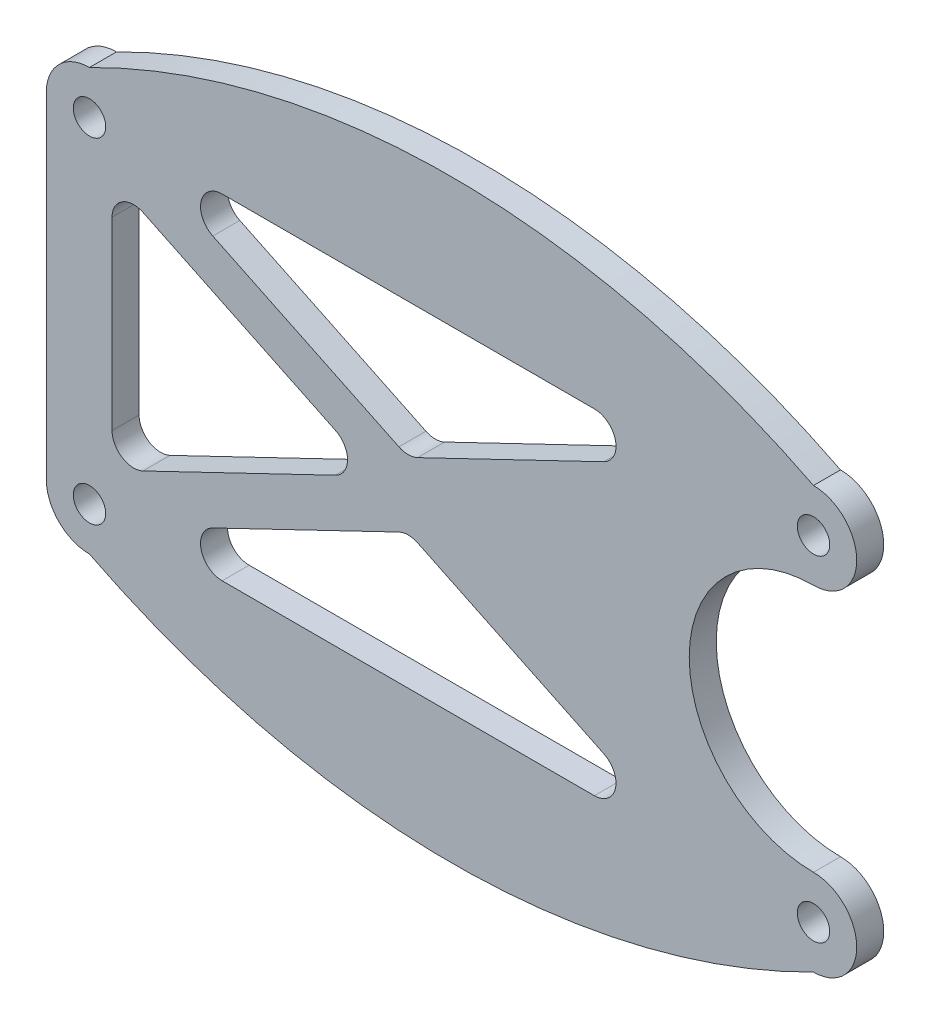
from build123d import *

# Parameters (mm, degrees)
CROQUIS2_R              = 1.5
SALIENTE_EXTRUIR1_DEPTH = 2.5
CORTAR_EXTRUIR1_DEPTH   = 2.5
REDONDEO1_R             = 2
SALIENTE_EXTRUIR2_DEPTH = 2.5


with BuildPart() as part:
    # Croquis2 → Saliente-Extruir1 (new body)
    with BuildSketch(Plane.XY):
        with BuildLine():
            Line((-97.318076, 19.5), (-30.318076, 19.5))
            ThreePointArc((-30.318076, 19.5), (-26.318076, 15.5), (-30.318076, 11.5))
            ThreePointArc((-30.318076, 11.5), (-41.818076, 0), (-30.318076, -11.5))
            ThreePointArc((-30.318076, -11.5), (-26.318076, -15.5), (-30.318076, -19.5))
            Line((-30.318076, -19.5), (-97.318076, -19.5))
            ThreePointArc((-97.318076, -19.5), (-100.146503125, -18.328427125), (-101.318076, -15.5))
            Line((-101.318076, -15.5), (-101.318076, 15.5))
            ThreePointArc((-101.318076, 15.5), (-100.146503125, 18.328427125), (-97.318076, 19.5))
        make_face()
        with Locations((-97.318076, 15.5)):
            Circle(CROQUIS2_R, mode=Mode.SUBTRACT)
        with Locations((-30.318076, 15.5)):
            Circle(CROQUIS2_R, mode=Mode.SUBTRACT)
        with Locations((-30.318076, -15.5)):
            Circle(CROQUIS2_R, mode=Mode.SUBTRACT)
        with Locations((-97.318076, -15.5)):
            Circle(CROQUIS2_R, mode=Mode.SUBTRACT)
    extrude(amount=SALIENTE_EXTRUIR1_DEPTH)

    # Croquis3 → Cortar-Extruir1 (cut)
    with BuildSketch(Plane.XY.offset(2.5)):
        Polygon((-67.818076, 3), (-41.818076, 15.5), (-93.818076, 15.5), align=None)
        Polygon((-67.818076, -3), (-93.818076, -15.5), (-41.818076, -15.5), align=None)
        Polygon((-70.818076, 0), (-95.228698469, 11.735876187), (-95.228698469, -11.735876187), align=None)
    extrude(amount=-CORTAR_EXTRUIR1_DEPTH, mode=Mode.SUBTRACT)

    # Redondeo1
    redondeo1_edges = [part.edges().sort_by_distance(p)[0] for p in [
        (-67.818076, -3, 1.25),
        (-41.818076, -15.5, 1.25),
        (-93.818076, -15.5, 1.25),
        (-70.818076, 0, 1.25),
        (-95.228698469, -11.735876187, 1.25),
        (-95.228698469, 11.735876187, 1.25),
        (-67.818076, 3, 1.25),
        (-93.818076, 15.5, 1.25),
        (-41.818076, 15.5, 1.25),
    ]]
    fillet(redondeo1_edges, radius=REDONDEO1_R)

    # Croquis5 → Saliente-Extruir2 (add)
    with BuildSketch(Plane.XY.offset(2.5)):
        with BuildLine():
            Line((-97.318076, 19.5), (-30.318076, 19.5))
            ThreePointArc((-30.318076, 19.5), (-63.818076, 27.5), (-97.318076, 19.5))
        make_face()
        with BuildLine():
            Line((-97.318076, -19.5), (-30.318076, -19.5))
            ThreePointArc((-30.318076, -19.5), (-63.818076, -27.5), (-97.318076, -19.5))
        make_face()
    extrude(amount=-SALIENTE_EXTRUIR2_DEPTH)


solid = part.part
